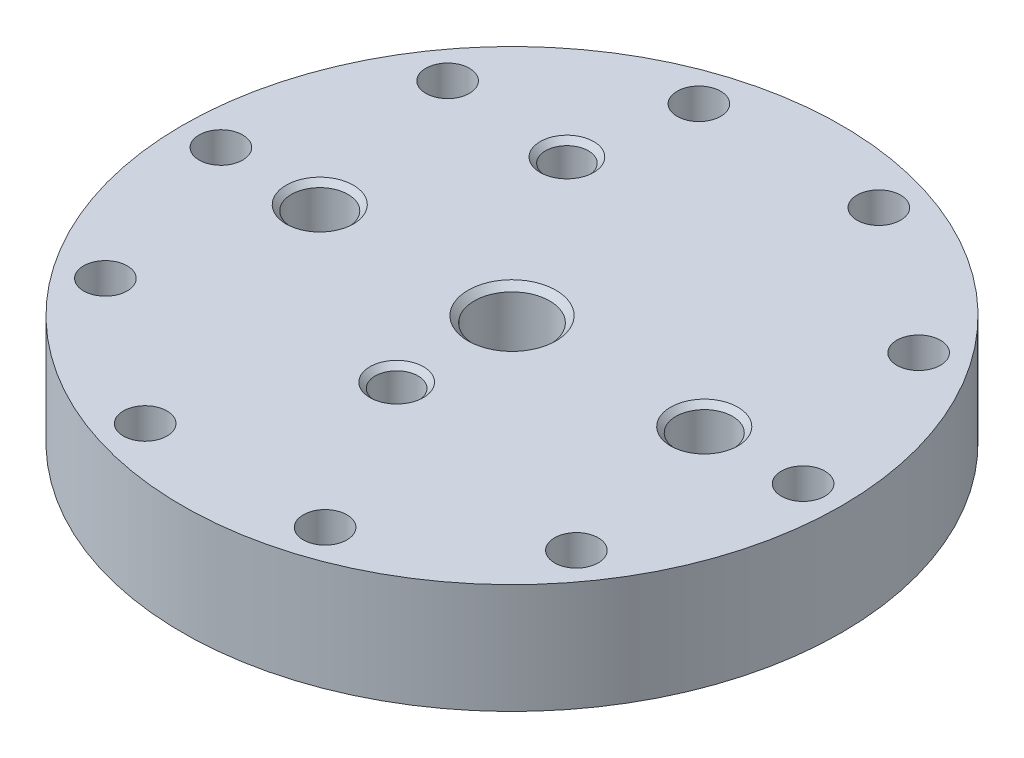
from build123d import *

# Parameters (mm, degrees)
F_3_4_16_TAPPED_HOLE1_D            = 17.4625
F_3_4_16_TAPPED_HOLE1_CSINK_D      = 20.32
F_3_4_16_TAPPED_HOLE1_CSINK_ANGLE  = 90
F_9_16_18_TAPPED_HOLE1_D           = 13.09624
F_9_16_18_TAPPED_HOLE1_CSINK_D     = 15.5575
F_9_16_18_TAPPED_HOLE1_CSINK_ANGLE = 90
F_3_8_CLEARANCE_HOLE2_D            = 10.0838
CIRPATTERN1_COUNT                  = 10
F_7_16_20_TAPPED_HOLE1_D           = 9.92124
F_7_16_20_TAPPED_HOLE1_DEPTH       = 14.799358796
F_7_16_20_TAPPED_HOLE1_CSINK_D     = 12.3825
F_7_16_20_TAPPED_HOLE1_CSINK_ANGLE = 90
F_7_16_20_TAPPED_HOLE1_TIP         = 2.980641204
F_7_16_20_TAPPED_HOLE2_D           = 9.92124
F_7_16_20_TAPPED_HOLE2_CSINK_D     = 12.3825
F_7_16_20_TAPPED_HOLE2_CSINK_ANGLE = 90
F_1_4_0_25_DIAMETER_HOLE2_D        = 6.35
F_1_4_0_25_DIAMETER_HOLE2_DEPTH    = 72.260267535
F_1_4_0_25_DIAMETER_HOLE2_TIP      = 1.907732465


with BuildPart() as part:
    # Sketch1 → Revolve1 (revolve)
    with BuildSketch(Plane.XY):
        Polygon((0, 0), (-76.2, 0), (-76.2, -25.4), (-58.8899, -25.4), (-58.8899, -22.7076), (-54.8259, -22.7076), (-54.8259, -25.4), (-36.6649, -25.4), (-36.6649, -22.7076), (-32.6009, -22.7076), (-32.6009, -25.4), (-31.0134, -25.4), (-31.0134, -24.765), (-10.9982, -19.812), (0, -13.462186269), align=None)
    revolve(axis=Axis((0, 0, 0), (0, -1, 0)))

    # 3/4-16 Tapped Hole1 (through all)
    with Locations(Plane(origin=(0, 0, 0), x_dir=(1, 0, 0), z_dir=(0, 1, 0))):
        with Locations((0, 0)):
            CounterSinkHole(F_3_4_16_TAPPED_HOLE1_D / 2, F_3_4_16_TAPPED_HOLE1_CSINK_D / 2, counter_sink_angle=F_3_4_16_TAPPED_HOLE1_CSINK_ANGLE)

    # 9/16-18 Tapped Hole1 (through all)
    with Locations(Plane(origin=(0, 0, 0), x_dir=(1, 0, 0), z_dir=(0, 1, 0))):
        with Locations((-44.45, 0), (44.45, 0)):
            CounterSinkHole(F_9_16_18_TAPPED_HOLE1_D / 2, F_9_16_18_TAPPED_HOLE1_CSINK_D / 2, counter_sink_angle=F_9_16_18_TAPPED_HOLE1_CSINK_ANGLE)

    # 3/8 Clearance Hole2 (through all)
    with Locations(Plane(origin=(67.31, 0, 0), x_dir=(0, 0, 1), z_dir=(0, 1, 0))):
        with Locations((0, 0)):
            f_3_8_clearance_hole2 = Hole(F_3_8_CLEARANCE_HOLE2_D / 2)

    # CirPattern1: 3/8 Clearance Hole2 ×10 about axis
    cirpattern1_axis = Axis((0, 0, 0), (0, 1, 0))
    for i in range(1, CIRPATTERN1_COUNT):
        add(f_3_8_clearance_hole2.rotate(cirpattern1_axis, i * 360 / CIRPATTERN1_COUNT), mode=Mode.SUBTRACT)

    # 7/16-20 Tapped Hole1
    with Locations(Plane(origin=(0, 0, 26.67), x_dir=(1, 0, 0), z_dir=(0, 1, 0))):
        with Locations((0, 0)):
            CounterSinkHole(F_7_16_20_TAPPED_HOLE1_D / 2, F_7_16_20_TAPPED_HOLE1_CSINK_D / 2, depth=F_7_16_20_TAPPED_HOLE1_DEPTH, counter_sink_angle=F_7_16_20_TAPPED_HOLE1_CSINK_ANGLE)
            with Locations((0, 0, -(F_7_16_20_TAPPED_HOLE1_DEPTH + F_7_16_20_TAPPED_HOLE1_TIP / 2))):  # 118° drill point
                Cone(0, F_7_16_20_TAPPED_HOLE1_D / 2, F_7_16_20_TAPPED_HOLE1_TIP, mode=Mode.SUBTRACT)

    # 7/16-20 Tapped Hole2 (through all)
    with Locations(Plane(origin=(-25.4, 0, -38.1), x_dir=(0, 0, 1), z_dir=(0, 1, 0))):
        with Locations((0, 0)):
            CounterSinkHole(F_7_16_20_TAPPED_HOLE2_D / 2, F_7_16_20_TAPPED_HOLE2_CSINK_D / 2, counter_sink_angle=F_7_16_20_TAPPED_HOLE2_CSINK_ANGLE)

    # 1/4 (0.25) Diameter Hole2
    with Locations(Plane(origin=(0, 0, 0), x_dir=(1, 0, 0), z_dir=(0, 1, 0))):
        with Locations((0, -26.67)):
            Hole(F_1_4_0_25_DIAMETER_HOLE2_D / 2, depth=F_1_4_0_25_DIAMETER_HOLE2_DEPTH)
            with Locations((0, 0, -(F_1_4_0_25_DIAMETER_HOLE2_DEPTH + F_1_4_0_25_DIAMETER_HOLE2_TIP / 2))):  # 118° drill point
                Cone(0, F_1_4_0_25_DIAMETER_HOLE2_D / 2, F_1_4_0_25_DIAMETER_HOLE2_TIP, mode=Mode.SUBTRACT)


solid = part.part
